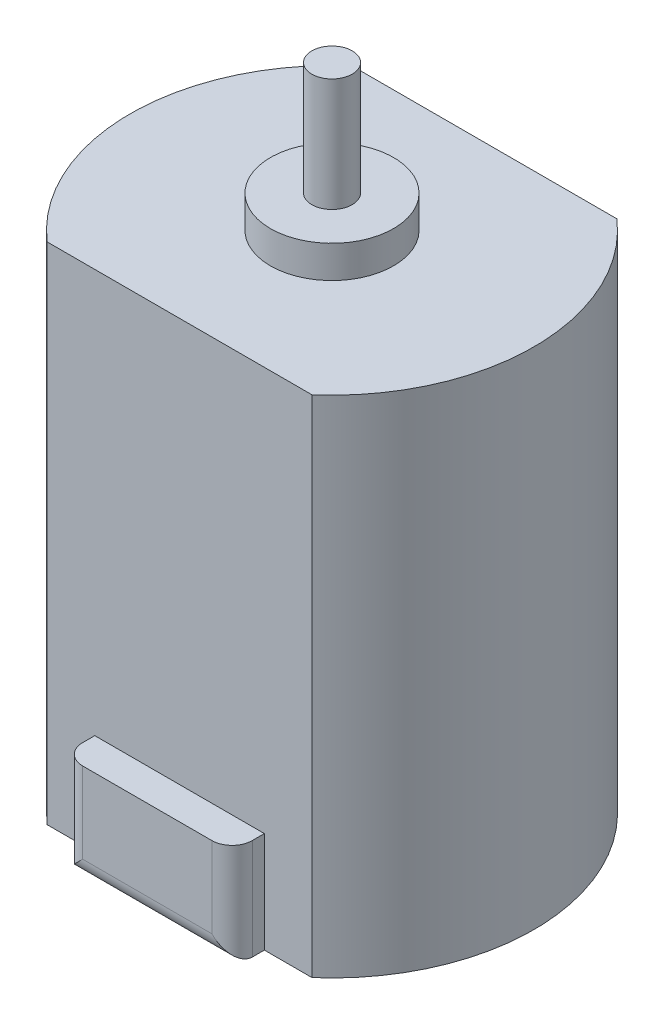
from build123d import *

# Parameters (mm, degrees)
BOSS_EXTRUDE1_DEPTH = 25
SKETCH2_R           = 3.05
BOSS_EXTRUDE2_DEPTH = 1.6
SKETCH3_R           = 1
BOSS_EXTRUDE3_DEPTH = 5.6
SKETCH4_R           = 4.95
BOSS_EXTRUDE4_DEPTH = 2.3
BOSS_EXTRUDE5_START = 1.5
SKETCH5_R           = 1
BOSS_EXTRUDE5_DEPTH = 1.5
SKETCH6_W           = 8.4
SKETCH6_H           = 5
BOSS_EXTRUDE6_DEPTH = 1.6
FILLET1_R           = 1


with BuildPart() as part:
    # Sketch1 → Boss-Extrude1 (new body)
    with BuildSketch(Plane(origin=(0, 0, 0), x_dir=(1, 0, 0), z_dir=(0, 1, 0))):
        with BuildLine():
            Line((6.557247898, 7.55), (-6.557247898, 7.55))
            ThreePointArc((-6.557247898, 7.55), (-10, 0), (-6.557247898, -7.55))
            Line((-6.557247898, -7.55), (6.557247898, -7.55))
            ThreePointArc((6.557247898, -7.55), (9.098694384, -4.148946916), (10, 0))
            ThreePointArc((10, 0), (9.098694384, 4.148946916), (6.557247898, 7.55))
        make_face()
    extrude(amount=BOSS_EXTRUDE1_DEPTH)

    # Sketch2 → Boss-Extrude2 (add)
    with BuildSketch(Plane(origin=(0, 25, 0), x_dir=(1, 0, 0), z_dir=(0, 1, 0))):
        with Locations(Location((0, 0, 0), (0, 0, 270))):
            Circle(SKETCH2_R)
    extrude(amount=BOSS_EXTRUDE2_DEPTH)

    # Sketch3 → Boss-Extrude3 (add)
    with BuildSketch(Plane(origin=(0, 26.6, 0), x_dir=(1, 0, 0), z_dir=(0, 1, 0))):
        with Locations(Location((0, 0, 0), (0, 0, 270))):
            Circle(SKETCH3_R)
    extrude(amount=BOSS_EXTRUDE3_DEPTH)

    # Sketch4 → Boss-Extrude4 (add)
    with BuildSketch(Plane.XZ):
        with Locations(Location((0, 0, 0), (0, 0, 270))):
            Circle(SKETCH4_R)
    extrude(amount=BOSS_EXTRUDE4_DEPTH)

    # Sketch5 → Boss-Extrude5 (add)
    with BuildSketch(Plane.XZ.offset(2.3).offset(BOSS_EXTRUDE5_START)):
        with Locations(Location((0, 0, 0), (0, 0, 90))):
            Circle(SKETCH5_R)
    extrude(amount=-BOSS_EXTRUDE5_DEPTH)

    # Sketch6 → Boss-Extrude6 (add)
    with BuildSketch(Plane.XY.offset(7.55)):
        with Locations((0, 2.5)):
            Rectangle(SKETCH6_W, SKETCH6_H)
    extrude(amount=BOSS_EXTRUDE6_DEPTH)

    # Fillet1
    fillet1_edges = [part.edges().sort_by_distance(p)[0] for p in [
        (-4.2, 2.5, 9.15),
        (0, 0, 9.15),
        (4.2, 2.5, 9.15),
    ]]
    fillet(fillet1_edges, radius=FILLET1_R)


solid = part.part
